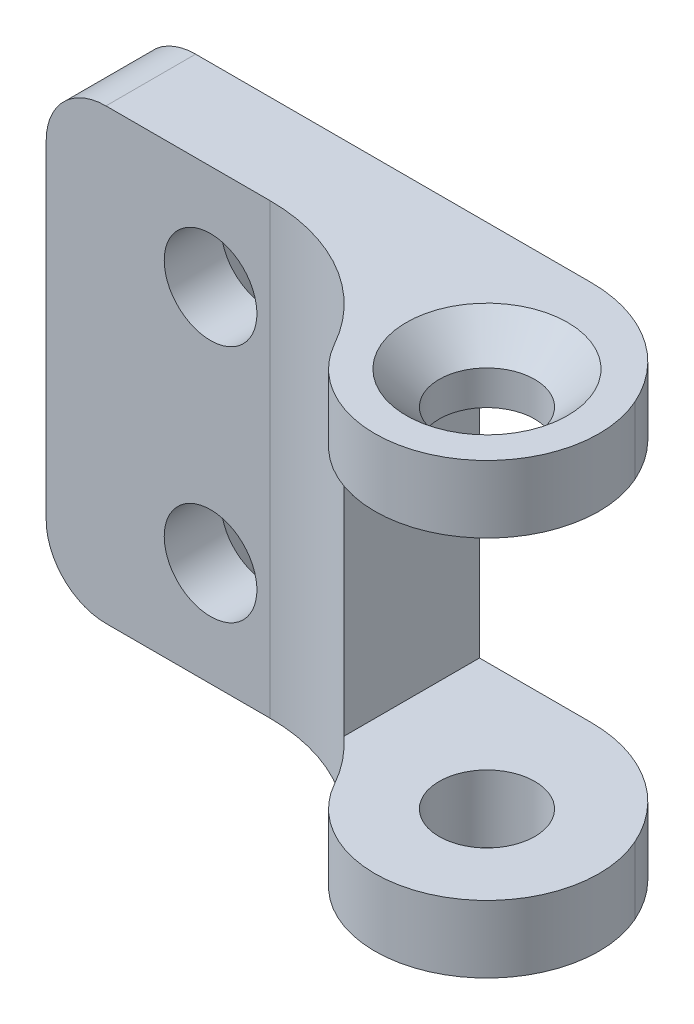
from build123d import *

# Parameters (mm, degrees)
SKETCH_1_R          = 3.2
EXTRUDE_1_DEPTH     = 30
FILLET_1_R          = 4
SKETCH_2_R          = 3.1
CUT_EXTRUDE_1_DEPTH = 47.69047012
SKETCH_3_W          = 22.462925105
SKETCH_3_H          = 21
CUT_EXTRUDE_2_DEPTH = 47.69047012
CHAMFER_1_SIZE      = 2.2
CHAMFER_2_SIZE      = 2.2
CHAMFER_3_SIZE      = 2.2


with BuildPart() as part:
    # Эскиз1 → Бобышка-Вытянуть1 (new body)
    with BuildSketch(Plane(origin=(0, 0, 0), x_dir=(1, 0, 0), z_dir=(0, 1, 0))):
        with BuildLine():
            Line((-32, 8.5), (-1.538396133, 8.5))
            ThreePointArc((-1.538396133, 8.5), (3.466562042, 7.016276971), (6.85424835, 3.044549155))
            ThreePointArc((6.85424835, 3.044549155), (3.352656053, -6.708926694), (-6.549763987, -3.653846154))
            ThreePointArc((-6.549763987, -3.653846154), (-10.952950163, 0.847797982), (-17.029386366, 2.5))
            Line((-17.029386366, 2.5), (-32, 2.5))
            Line((-32, 2.5), (-32, 8.5))
        make_face()
        with Locations(Location((0, 0, 0), (0, 0, 270))):
            Circle(SKETCH_1_R, mode=Mode.SUBTRACT)
    extrude(amount=EXTRUDE_1_DEPTH)

    # Скругление1
    fillet_1_edges = [part.edges().sort_by_distance(p)[0] for p in [
        (-32, 30, -5.5),
        (-32, 0, -5.5),
    ]]
    fillet(fillet_1_edges, radius=FILLET_1_R)

    # Эскиз2 → Вырез-Вытянуть1 (cut, through all)
    with BuildSketch(Plane(origin=(0, 0, -8.5), x_dir=(-1, 0, 0), z_dir=(0, 0, -1))):
        with Locations((21, 23)):
            Circle(SKETCH_2_R)
        with Locations((21, 7)):
            Circle(SKETCH_2_R)
    extrude(amount=-CUT_EXTRUDE_1_DEPTH, mode=Mode.SUBTRACT)

    # Эскиз3 → Вырез-Вытянуть2 (cut, through all)
    with BuildSketch(Plane(origin=(0, 0, -8.5), x_dir=(-1, 0, 0), z_dir=(0, 0, -1))):
        with Locations((-2.231462553, 15)):
            Rectangle(SKETCH_3_W, SKETCH_3_H)
    extrude(amount=-CUT_EXTRUDE_2_DEPTH, mode=Mode.SUBTRACT)

    # Фаска1
    chamfer_1_edges = [part.edges().sort_by_distance(p)[0] for p in [
        (0, 30, -3.2),
    ]]
    chamfer(chamfer_1_edges, length=CHAMFER_1_SIZE)

    # Фаска2
    chamfer_2_edges = [part.edges().sort_by_distance(p)[0] for p in [
        (-17.9, 23, -8.5),
    ]]
    chamfer(chamfer_2_edges, length=CHAMFER_2_SIZE)

    # Фаска3
    chamfer_3_edges = [part.edges().sort_by_distance(p)[0] for p in [
        (-17.9, 7, -8.5),
    ]]
    chamfer(chamfer_3_edges, length=CHAMFER_3_SIZE)


solid = part.part
